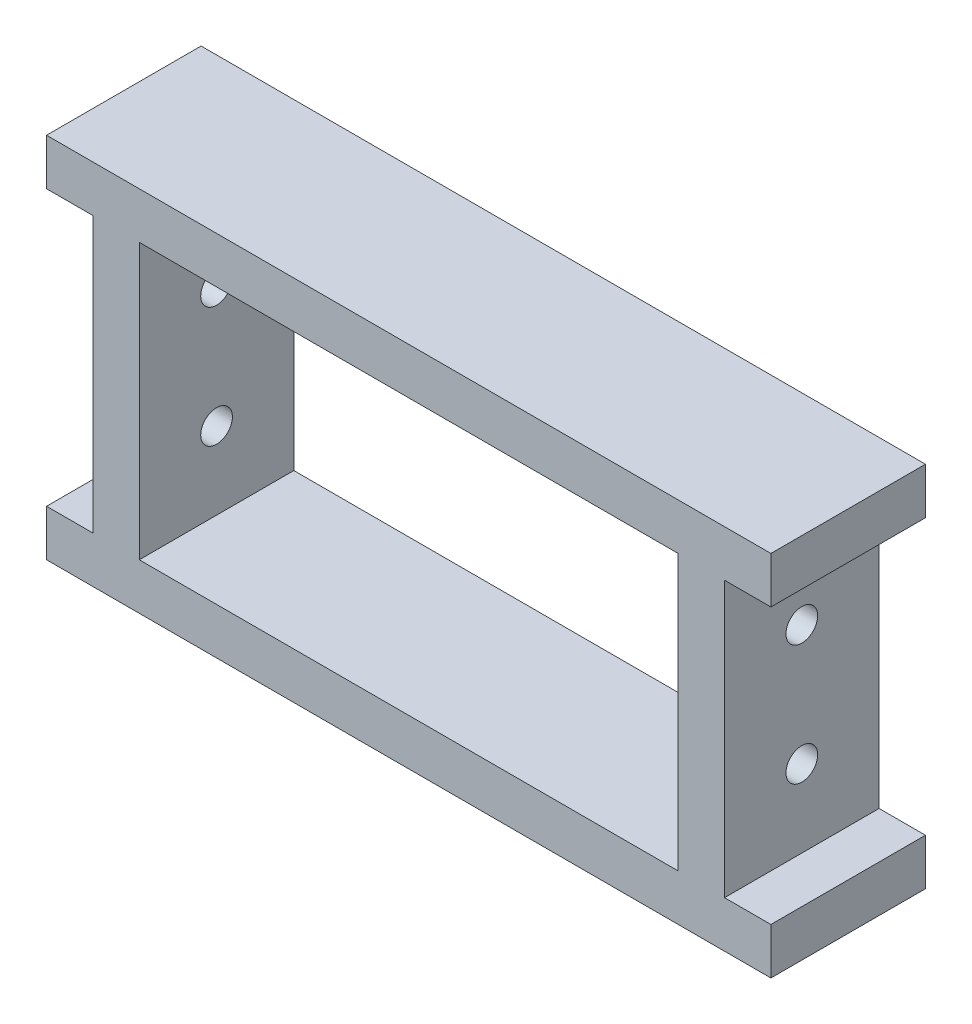
from build123d import *

# Parameters (mm, degrees)
SKETCH1_W                    = 34.867947861
SKETCH1_H                    = 17.79
BOSS_EXTRUDE1_DEPTH          = 10
M2_5X0_45_TAPPED_HOLE2_D     = 2.05
M2_5X0_45_TAPPED_HOLE2_DEPTH = 7.25
M2_5X0_45_TAPPED_HOLE2_TIP   = 0.615882135
M2_5X0_45_TAPPED_HOLE1_D     = 2.05
M2_5X0_45_TAPPED_HOLE1_DEPTH = 7.25
M2_5X0_45_TAPPED_HOLE1_TIP   = 0.615882135


with BuildPart() as part:
    # Sketch1 → Boss-Extrude1 (new body)
    with BuildSketch(Plane.XY):
        Polygon((6.149632379, 9.551958914), (9.149632379, 9.551958914), (9.149632379, 12.551958914), (-37.718315482, 12.551958914), (-37.718315482, 9.551958914), (-34.718315482, 9.551958914), (-34.718315482, -8.238041086), (-37.718315482, -8.238041086), (-37.718315482, -11.238041086), (9.149632379, -11.238041086), (9.149632379, -8.238041086), (6.149632379, -8.238041086), align=None)
        with Locations((-14.284341552, 0.656958914)):
            Rectangle(SKETCH1_W, SKETCH1_H, mode=Mode.SUBTRACT)
    extrude(amount=BOSS_EXTRUDE1_DEPTH)

    # M2.5x0.45 Tapped Hole2
    with Locations(Plane.ZY.offset(34.718315482)):
        with Locations((5, 4.551958914), (5, -3.238041086)):
            Hole(M2_5X0_45_TAPPED_HOLE2_D / 2, depth=M2_5X0_45_TAPPED_HOLE2_DEPTH)
            with Locations((0, 0, -(M2_5X0_45_TAPPED_HOLE2_DEPTH + M2_5X0_45_TAPPED_HOLE2_TIP / 2))):  # 118° drill point
                Cone(0, M2_5X0_45_TAPPED_HOLE2_D / 2, M2_5X0_45_TAPPED_HOLE2_TIP, mode=Mode.SUBTRACT)

    # M2.5x0.45 Tapped Hole1
    with Locations(Plane(origin=(6.149632379, 2.476678441, 1.606875776), x_dir=(0, 0, -1), z_dir=(1, 0, 0))):
        with Locations((-3.393124224, 2.075280473), (-3.393124224, -5.714719527)):
            Hole(M2_5X0_45_TAPPED_HOLE1_D / 2, depth=M2_5X0_45_TAPPED_HOLE1_DEPTH)
            with Locations((0, 0, -(M2_5X0_45_TAPPED_HOLE1_DEPTH + M2_5X0_45_TAPPED_HOLE1_TIP / 2))):  # 118° drill point
                Cone(0, M2_5X0_45_TAPPED_HOLE1_D / 2, M2_5X0_45_TAPPED_HOLE1_TIP, mode=Mode.SUBTRACT)


solid = part.part
